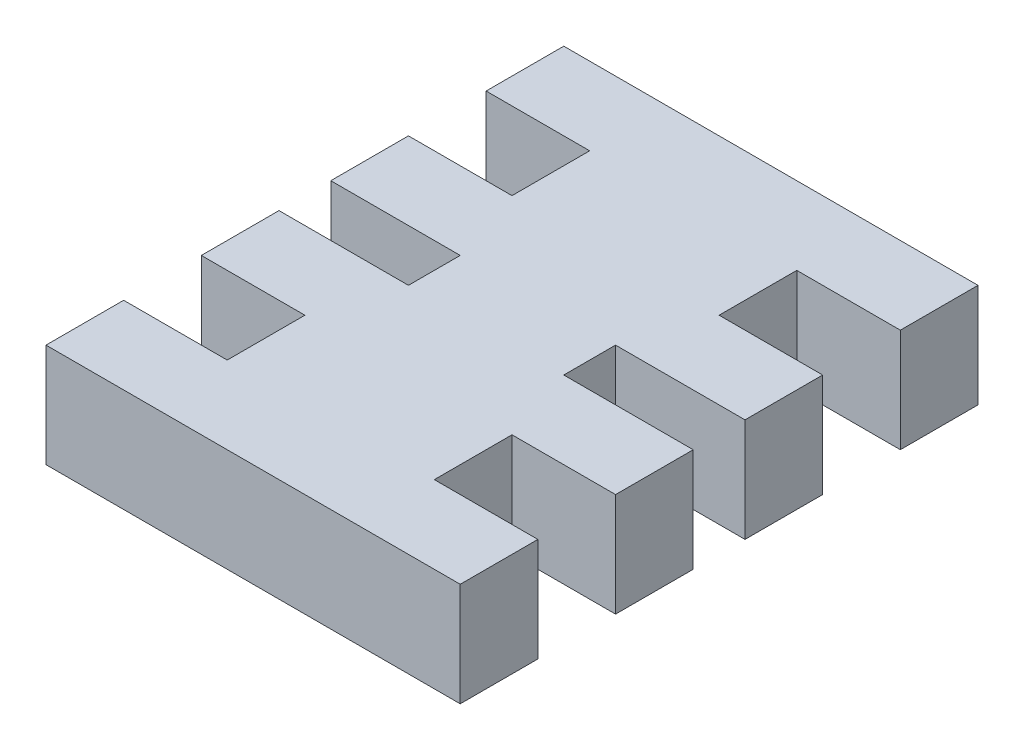
from build123d import *

# Parameters (mm, degrees)
BOSS_EXTRUDE1_DEPTH = 20


with BuildPart() as part:
    # Sketch2 → Boss-Extrude1 (new body)
    with BuildSketch(Plane(origin=(0, 0, 0), x_dir=(1, 0, 0), z_dir=(0, 1, 0))):
        Polygon((40, 50), (-40, 50), (-40, 35), (-20, 35), (-20, 20), (-40, 20), (-40, 5), (-15, 5), (-15, -5), (-40, -5), (-40, -20), (-20, -20), (-20, -35), (-40, -35), (-40, -50), (40, -50), (40, -35), (20, -35), (20, -20), (40, -20), (40, -5), (15, -5), (15, 5), (40, 5), (40, 20), (20, 20), (20, 35), (40, 35), align=None)
    extrude(amount=BOSS_EXTRUDE1_DEPTH)


solid = part.part
